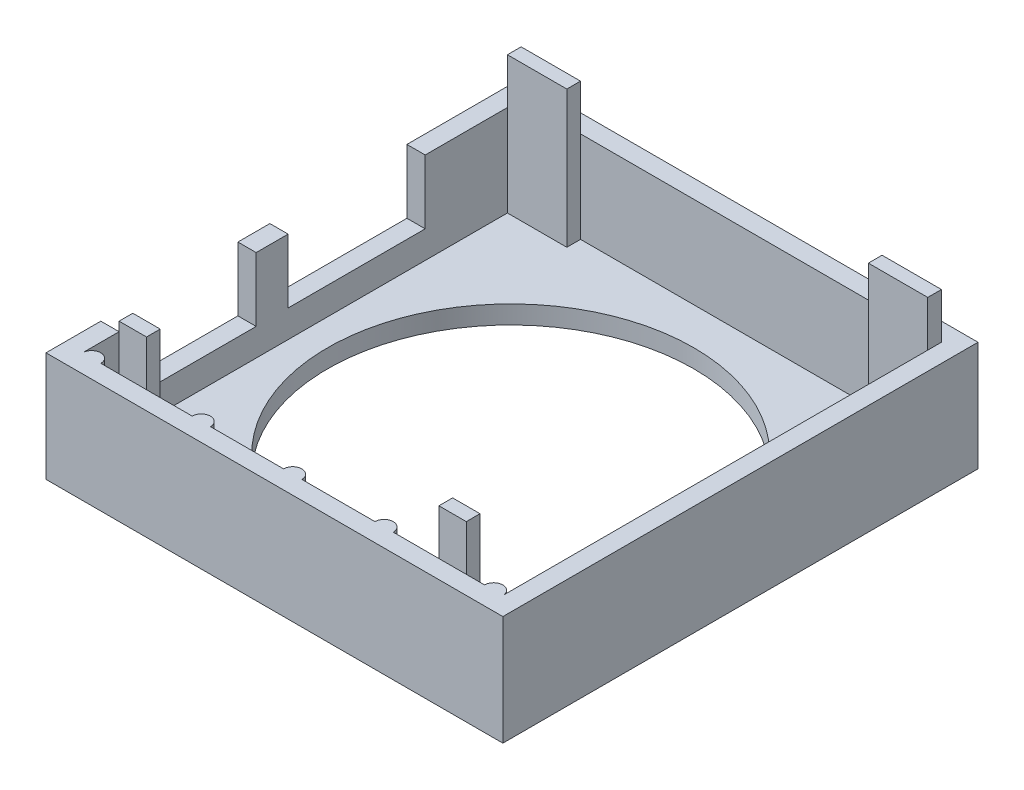
from build123d import *

# Parameters (mm, degrees)
SKETCH2_W           = 50
SKETCH2_H           = 52
BOSS_EXTRUDE1_DEPTH = 12
SKETCH5_W           = 46
SKETCH5_H           = 48
CUT_EXTRUDE1_DEPTH  = 10
SKETCH7_W           = 2
SKETCH7_H           = 15
CUT_EXTRUDE2_DEPTH  = 7
SKETCH10_R          = 1
BOSS_EXTRUDE2_DEPTH = 10
SKETCH11_W          = 3
SKETCH11_H          = 1.5
SKETCH11_W_2        = 6.5
SKETCH11_H_2        = 1.499602214
BOSS_EXTRUDE3_DEPTH = 15
SKETCH12_R          = 20.034029424
CUT_EXTRUDE4_DEPTH  = 15


with BuildPart() as part:
    # Sketch2 → Boss-Extrude1 (new body)
    with BuildSketch(Plane(origin=(0, 0, 0), x_dir=(1, 0, 0), z_dir=(0, 1, 0))):
        with Locations((25, 26)):
            Rectangle(SKETCH2_W, SKETCH2_H)
    extrude(amount=BOSS_EXTRUDE1_DEPTH)

    # Sketch5 → Cut-Extrude1 (cut)
    with BuildSketch(Plane(origin=(0, 12, 0), x_dir=(1, 0, 0), z_dir=(0, 1, 0))):
        with Locations((25, 26)):
            Rectangle(SKETCH5_W, SKETCH5_H)
    extrude(amount=-CUT_EXTRUDE1_DEPTH, mode=Mode.SUBTRACT)

    # Sketch7 → Cut-Extrude2 (cut)
    with BuildSketch(Plane(origin=(0, 12, 0), x_dir=(1, 0, 0), z_dir=(0, 1, 0))):
        with Locations((1, 32)):
            Rectangle(SKETCH7_W, SKETCH7_H)
        with Locations((1, 13.5)):
            Rectangle(SKETCH7_W, SKETCH7_H)
    extrude(amount=-CUT_EXTRUDE2_DEPTH, mode=Mode.SUBTRACT)

    # Sketch10 → Boss-Extrude2 (add)
    with BuildSketch(Plane(origin=(0, 2, 0), x_dir=(1, 0, 0), z_dir=(0, 1, 0))):
        with Locations((25, 2)):
            Circle(SKETCH10_R)
        with Locations((35, 2)):
            Circle(SKETCH10_R)
        with Locations((15, 2)):
            Circle(SKETCH10_R)
        with Locations((3, 2)):
            Circle(SKETCH10_R)
        with Locations((47, 2)):
            Circle(SKETCH10_R)
    extrude(amount=BOSS_EXTRUDE2_DEPTH)

    # Sketch11 → Boss-Extrude3 (add)
    with BuildSketch(Plane(origin=(0, 2, 0), x_dir=(1, 0, 0), z_dir=(0, 1, 0))):
        with Locations((7.5, 2.75)):
            Rectangle(SKETCH11_W, SKETCH11_H)
        with Locations((42.5, 2.75)):
            Rectangle(SKETCH11_W, SKETCH11_H)
        with Locations((5.25, 49.250198893)):
            Rectangle(SKETCH11_W_2, SKETCH11_H_2)
        with Locations((44.75, 49.250198893)):
            Rectangle(SKETCH11_W_2, SKETCH11_H_2)
    extrude(amount=BOSS_EXTRUDE3_DEPTH)

    # Sketch12 → Cut-Extrude4 (cut)
    with BuildSketch(Plane(origin=(0, 2, 0), x_dir=(1, 0, 0), z_dir=(0, 1, 0))):
        with Locations(Location((24.959746772, 25.897804051, 0), (0, 0, 270))):
            Circle(SKETCH12_R)
    extrude(amount=-CUT_EXTRUDE4_DEPTH, mode=Mode.SUBTRACT)


solid = part.part
